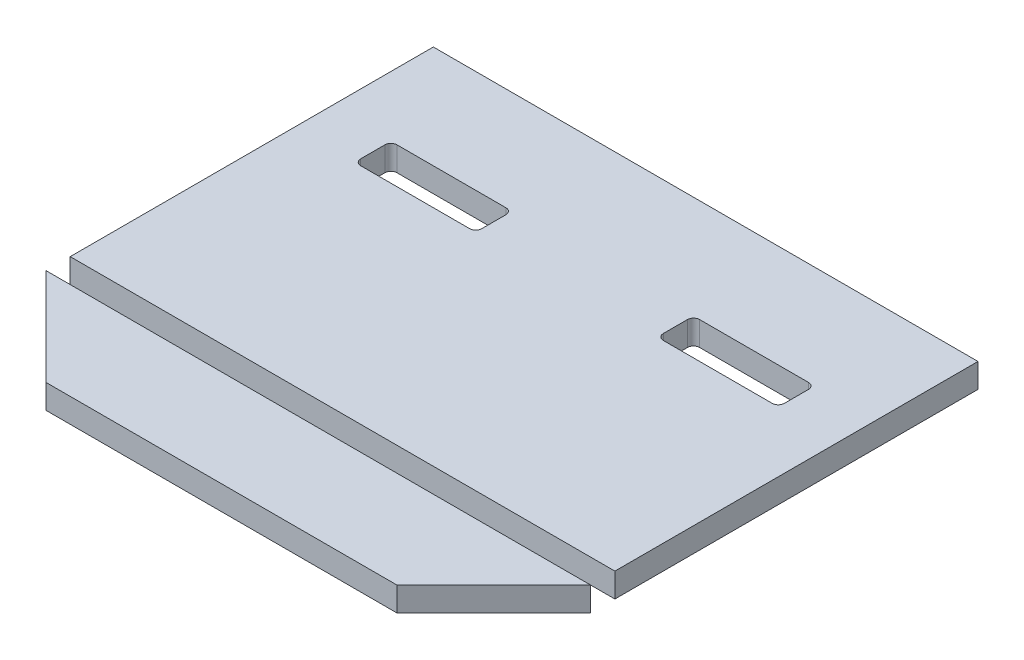
from build123d import *

# Parameters (mm, degrees)
SKETCH1_W             = 45
SKETCH1_H             = 30
BOSS_EXTRUDE7_DEPTH   = 2
BOSS_EXTRUDE7_2_DEPTH = 2


with BuildPart() as part:
    # Sketch1 → Boss-Extrude7 (new body)
    with BuildSketch(Plane(origin=(0, 0, 0), x_dir=(1, 0, 0), z_dir=(0, 1, 0))):
        Rectangle(SKETCH1_W, SKETCH1_H)
        with BuildLine():
            ThreePointArc((-7.5, 5.998187631), (-7.646446609, 6.351741022), (-8, 6.498187631))
            Line((-8, 6.498187631), (-17, 6.498187631))
            ThreePointArc((-17, 6.498187631), (-17.353553391, 6.351741022), (-17.5, 5.998187631))
            Line((-17.5, 5.998187631), (-17.5, 4.001812369))
            ThreePointArc((-17.5, 4.001812369), (-17.353553391, 3.648258978), (-17, 3.501812369))
            Line((-17, 3.501812369), (-8, 3.501812369))
            ThreePointArc((-8, 3.501812369), (-7.646446609, 3.648258978), (-7.5, 4.001812369))
            Line((-7.5, 4.001812369), (-7.5, 5.998187631))
        make_face(mode=Mode.SUBTRACT)
        with BuildLine():
            Line((7.5, 5.998187631), (7.5, 4.001812369))
            ThreePointArc((7.5, 4.001812369), (7.646446609, 3.648258978), (8, 3.501812369))
            Line((8, 3.501812369), (17, 3.501812369))
            ThreePointArc((17, 3.501812369), (17.353553391, 3.648258978), (17.5, 4.001812369))
            Line((17.5, 4.001812369), (17.5, 5.998187631))
            ThreePointArc((17.5, 5.998187631), (17.353553391, 6.351741022), (17, 6.498187631))
            Line((17, 6.498187631), (8, 6.498187631))
            ThreePointArc((8, 6.498187631), (7.646446609, 6.351741022), (7.5, 5.998187631))
        make_face(mode=Mode.SUBTRACT)
    extrude(amount=BOSS_EXTRUDE7_DEPTH)


with BuildPart() as body_2:
    # Sketch1 → Boss-Extrude7 2 (new body)
    with BuildSketch(Plane(origin=(0, 0, 0), x_dir=(1, 0, 0), z_dir=(0, 1, 0))):
        Polygon((22.5, -17), (14.5, -25), (-14.5, -25), (-22.5, -17), align=None)
    extrude(amount=BOSS_EXTRUDE7_2_DEPTH)


solid = Compound([part.part, body_2.part])
